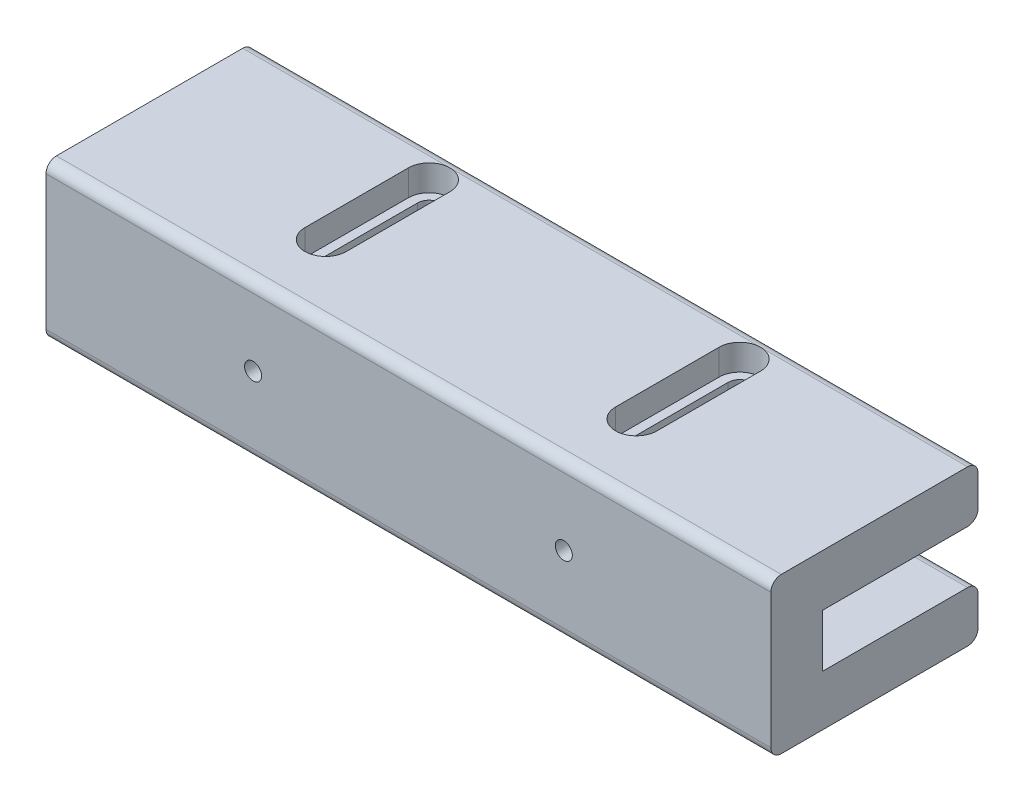
from build123d import *

# Parameters (mm, degrees)
ESQUISSE1_W             = 40
ESQUISSE1_H             = 30
BOSS_EXTRU_1_DEPTH      = 70
ESQUISSE2_W             = 30
ESQUISSE2_H             = 10.2
ENL_V_MAT_EXTRU_1_DEPTH = 100
CONG_1_R                = 2
ENL_V_MAT_EXTRU_2_REACH = 88.023
ENL_V_MAT_EXTRU_3_DEPTH = 5
TROU_TARAUD_M41_D       = 3.3


with BuildPart() as part:
    # Esquisse1 → Boss.-Extru.1 (new, symmetric)
    with BuildSketch(Plane(origin=(0, 0, 0), x_dir=(0, 0, -1), z_dir=(1, 0, 0))):
        with Locations((-20, 0)):
            Rectangle(ESQUISSE1_W, ESQUISSE1_H)
    extrude(amount=BOSS_EXTRU_1_DEPTH, both=True)

    # Esquisse2 → Enlèv. mat.-Extru.1 (cut, symmetric)
    with BuildSketch(Plane(origin=(0, 0, 0), x_dir=(0, 0, -1), z_dir=(1, 0, 0))):
        with Locations((-15, -0.1)):
            Rectangle(ESQUISSE2_W, ESQUISSE2_H)
    extrude(amount=ENL_V_MAT_EXTRU_1_DEPTH, both=True, mode=Mode.SUBTRACT)

    # Congé1
    cong_1_edges = [part.edges().sort_by_distance(p)[0] for p in [
        (0, 5, 0),
        (0, -5.2, 0),
        (0, -15, 0),
        (0, -15, 40),
        (0, 15, 40),
        (0, 15, 0),
    ]]
    fillet(cong_1_edges, radius=CONG_1_R)

    # Esquisse5 → Enlèv. mat.-Extru.2 (cut, up to next)
    with BuildSketch(Plane(origin=(0, 15, 0), x_dir=(1, 0, 0), z_dir=(0, 1, 0)), mode=Mode.PRIVATE) as enl_v_mat_extru_2_sk1:
        with BuildLine():
            Line((-32.25, -6), (-32.25, -26))
            ThreePointArc((-32.25, -26), (-30, -28.25), (-27.75, -26))
            Line((-27.75, -26), (-27.75, -6))
            ThreePointArc((-27.75, -6), (-30, -3.75), (-32.25, -6))
        make_face()
    enl_v_mat_extru_2_tool1 = extrude(enl_v_mat_extru_2_sk1.sketch, amount=-ENL_V_MAT_EXTRU_2_REACH, mode=Mode.PRIVATE) & part.part
    # Esquisse5 → Enlèv. mat.-Extru.2 (cut, up to next)
    with BuildSketch(Plane(origin=(0, 15, 0), x_dir=(1, 0, 0), z_dir=(0, 1, 0)), mode=Mode.PRIVATE) as enl_v_mat_extru_2_sk2:
        with BuildLine():
            Line((32.25, -6), (32.25, -26))
            ThreePointArc((32.25, -26), (30, -28.25), (27.75, -26))
            Line((27.75, -26), (27.75, -6))
            ThreePointArc((27.75, -6), (30, -3.75), (32.25, -6))
        make_face()
    enl_v_mat_extru_2_tool2 = extrude(enl_v_mat_extru_2_sk2.sketch, amount=-ENL_V_MAT_EXTRU_2_REACH, mode=Mode.PRIVATE) & part.part
    add(enl_v_mat_extru_2_tool1.solids().sort_by_distance((-30, 15, 16))[0], mode=Mode.SUBTRACT)
    add(enl_v_mat_extru_2_tool2.solids().sort_by_distance((30, 15, 16))[0], mode=Mode.SUBTRACT)

    # Esquisse6 → Enlèv. mat.-Extru.3 (cut)
    with BuildSketch(Plane(origin=(0, 15, 0), x_dir=(1, 0, 0), z_dir=(0, 1, 0))):
        with BuildLine():
            Line((-34, -6), (-34, -26))
            ThreePointArc((-34, -26), (-30, -30), (-26, -26))
            Line((-26, -26), (-26, -6))
            ThreePointArc((-26, -6), (-30, -2), (-34, -6))
        make_face()
        with BuildLine():
            Line((26, -6), (26, -26))
            ThreePointArc((26, -26), (30, -30), (34, -26))
            Line((34, -26), (34, -6))
            ThreePointArc((34, -6), (30, -2), (26, -6))
        make_face()
    extrude(amount=-ENL_V_MAT_EXTRU_3_DEPTH, mode=Mode.SUBTRACT)

    # Trou taraudé M41 (through all)
    with Locations(Plane.XY.offset(40)):
        with Locations((-30, 0), (30, 0)):
            Hole(TROU_TARAUD_M41_D / 2)


solid = part.part
